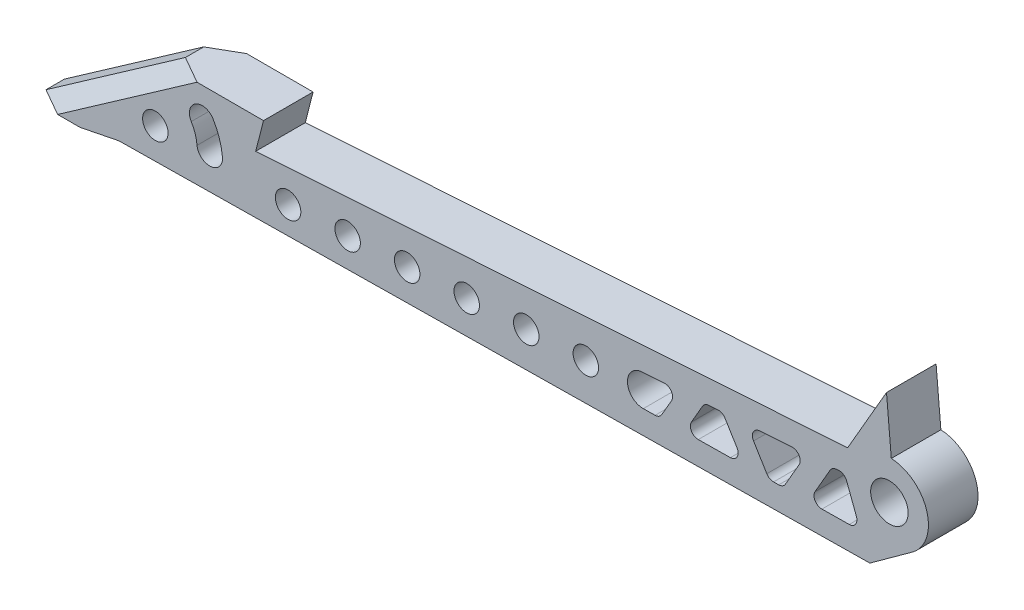
from build123d import *

# Parameters (mm, degrees)
SKETCH1_R           = 3.2639
SKETCH1_R_2         = 4.8025
BOSS_EXTRUDE1_DEPTH = 12.7
EXTRUDE_THIN1_DEPTH = 12.7
FILLET1_R           = 2
SKETCH3_R           = 3.2639
CUT_EXTRUDE1_DEPTH  = 222.669325799
CHAMFER1_SIZE       = 4


with BuildPart() as part:
    # Sketch1 → Boss-Extrude1 (new body)
    with BuildSketch(Plane.XY):
        with BuildLine():
            Line((-220, -20.475), (-207.3, -20.475))
            Line((-207.3, -20.475), (-197.3, -18.475))
            Line((-197.3, -18.475), (-5, -15.975))
            Line((-5, -15.975), (5.868885021, -8.096677628))
            ThreePointArc((5.868885021, -8.096677628), (9.584297561, 2.85328587), (0.484930071, 9.988235221))
            Line((0.484930071, 9.988235221), (-0.740940503, 24))
            Line((-0.740940503, 24), (-10.691733631, 6.764720727))
            Line((-10.691733631, 6.764720727), (-162.296299831, -3.282137227))
            Line((-162.296299831, -3.282137227), (-160.296299831, 4.525))
            Line((-160.296299831, 4.525), (-184.296299831, 4.525))
            Line((-184.296299831, 4.525), (-220, -20.475))
        make_face()
        with Locations((-154, -10.975)):
            Circle(SKETCH1_R, mode=Mode.SUBTRACT)
        with BuildLine():
            ThreePointArc((-135.489653222, -10.110575335), (-138.597743308, -13.523178805), (-142.010346778, -10.415088719))
            ThreePointArc((-142.010346778, -10.415088719), (-138.902256692, -7.00248525), (-135.489653222, -10.110575335))
        make_face(mode=Mode.SUBTRACT)
        with BuildLine():
            ThreePointArc((-120.239653222, -9.398407362), (-123.347743308, -12.811010832), (-126.760346778, -9.702920746))
            ThreePointArc((-126.760346778, -9.702920746), (-123.652256692, -6.290317277), (-120.239653222, -9.398407362))
        make_face(mode=Mode.SUBTRACT)
        with BuildLine():
            ThreePointArc((-104.989653222, -8.686239389), (-108.097743308, -12.098842859), (-111.510346778, -8.990752773))
            ThreePointArc((-111.510346778, -8.990752773), (-108.402256692, -5.578149304), (-104.989653222, -8.686239389))
        make_face(mode=Mode.SUBTRACT)
        with BuildLine():
            ThreePointArc((-89.739653222, -7.974071416), (-92.847743308, -11.386674886), (-96.260346778, -8.2785848))
            ThreePointArc((-96.260346778, -8.2785848), (-93.152256692, -4.865981331), (-89.739653222, -7.974071416))
        make_face(mode=Mode.SUBTRACT)
        with Locations((-77.75, -7.414160135)):
            Circle(SKETCH1_R, mode=Mode.SUBTRACT)
        with BuildLine():
            ThreePointArc((-63.032372648, -10.728944003), (-67.081236547, -6.887586999), (-63.348870778, -2.738036629))
            Line((-63.348870778, -2.738036629), (-11.492502478, 0.698492886))
            Line((-11.492502478, 0.698492886), (-7.437965658, -10.006187802))
            Line((-7.437965658, -10.006187802), (-63.032372648, -10.728944003))
        make_face(mode=Mode.SUBTRACT)
        Circle(SKETCH1_R_2, mode=Mode.SUBTRACT)
    extrude(amount=BOSS_EXTRUDE1_DEPTH)

    # Sketch2 → Extrude-Thin1 (add)
    with BuildSketch(Plane.XY.offset(12.7)):
        Polygon((-18.82367626, 4.244152852), (-20.32367626, 1.646076641), (-26.38156986, -8.846502861), (-27.88156986, -11.444579073), (-23.11843014, -14.194579073), (-21.61843014, -11.596502861), (-15.560536539, -1.103923359), (-14.060536539, 1.494152852), align=None)
        Polygon((-29.564922949, -12.326360556), (-31.654014309, -8.915246766), (-37.279649193, 0.270412174), (-39.368740553, 3.681525964), (-44.059022015, 0.809025344), (-41.969930654, -2.602088446), (-36.34429577, -11.787747387), (-34.25520441, -15.198861177), align=None)
        Polygon((-51.506359784, 2.078266381), (-53.006359784, -0.51980983), (-58.05148802, -9.258228266), (-59.55148802, -11.856304478), (-54.7883483, -14.606304478), (-53.2883483, -12.008228266), (-48.243220063, -3.26980983), (-46.743220063, -0.671733619), align=None)
    extrude(amount=-EXTRUDE_THIN1_DEPTH)

    # Fillet1
    fillet1_edges = [part.edges().sort_by_distance(p)[0] for p in [
        (-37.198435549, -10.393089387, 6.35),
        (-42.723767146, -1.371207834, 6.35),
        (-30.79987453, -10.309904766, 6.35),
        (-36.525812701, -0.960468438, 6.35),
        (-58.869359177, -10.674822663, 6.35),
        (-53.926545163, -2.113617659, 6.35),
        (-52.470477143, -10.591633869, 6.35),
        (-47.323034685, -1.676002002, 6.35),
        (-7.437965658, -10.006187802, 6.35),
        (-11.492502478, 0.698492886, 6.35),
        (-14.640351161, 0.489884469, 6.35),
        (-21.243861639, 0.052268813, 6.35),
        (-27.199441017, -10.263097258, 6.35),
        (-20.800558983, -10.179908464, 6.35),
    ]]
    fillet(fillet1_edges, radius=FILLET1_R)

    # Sketch3 → Cut-Extrude1 (cut, through all)
    with BuildSketch(Plane.XY.offset(12.7)):
        with Locations((-188, -10.475)):
            Circle(SKETCH3_R)
        with BuildLine():
            ThreePointArc((-170.811018785, -8.85662125), (-171.599559812, -5.080022092), (-173.207049233, -1.57281866))
            ThreePointArc((-173.207049233, -1.57281866), (-177.688057419, -0.458809846), (-178.802066233, -4.939818032))
            ThreePointArc((-178.802066233, -4.939818032), (-177.802564412, -7.120520542), (-177.31226682, -9.468727432))
            ThreePointArc((-177.31226682, -9.468727432), (-173.755589711, -12.413298359), (-170.811018785, -8.85662125))
        make_face()
    extrude(amount=-CUT_EXTRUDE1_DEPTH, mode=Mode.SUBTRACT)

    # Chamfer1
    chamfer1_edges = [part.edges().sort_by_distance(p)[0] for p in [
        (-202.148149916, -7.975, 0),
        (-202.148149916, -7.975, 12.7),
    ]]
    chamfer(chamfer1_edges, length=CHAMFER1_SIZE)


solid = part.part
